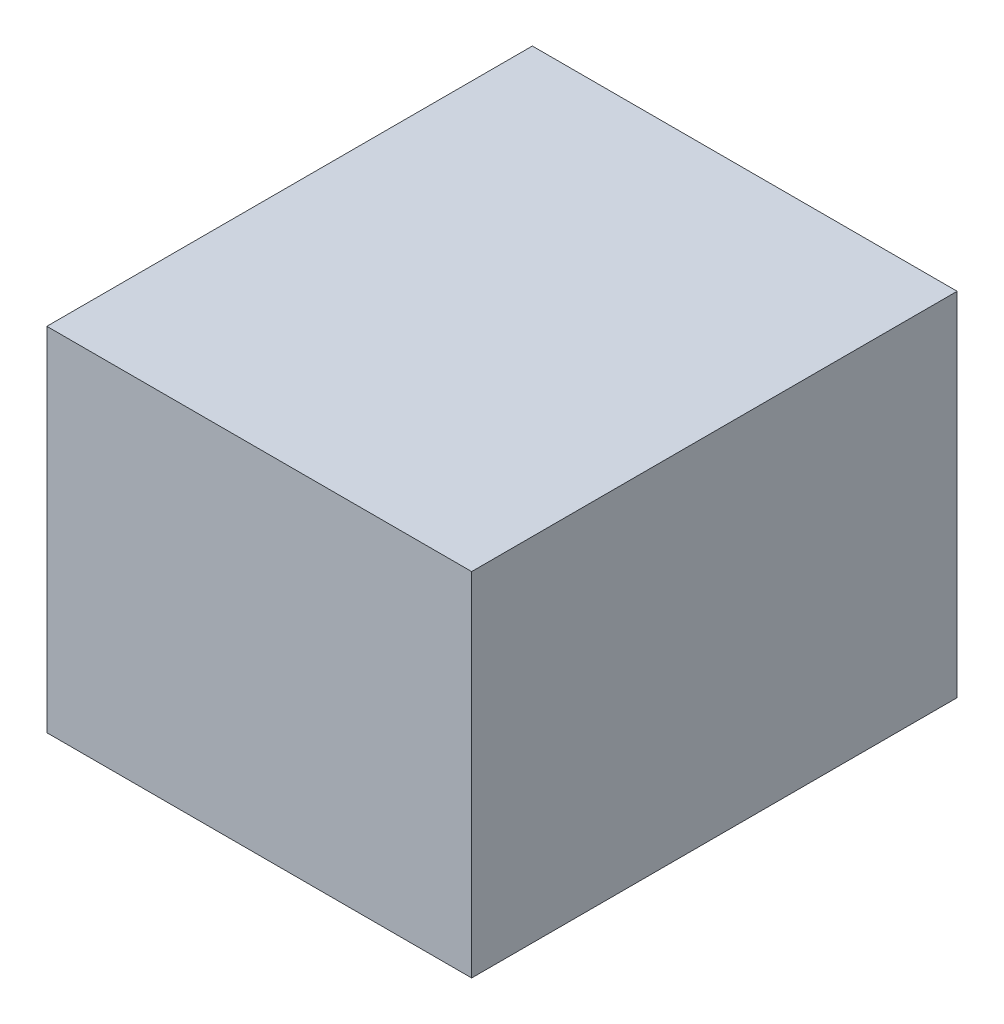
from build123d import *

# Parameters (mm, degrees)
CROQUIS1_W              = 35
CROQUIS1_H              = 40
SALIENTE_EXTRUIR1_DEPTH = 29


with BuildPart() as part:
    # Croquis1 → Saliente-Extruir1 (new body)
    with BuildSketch(Plane(origin=(0, 0, 0), x_dir=(1, 0, 0), z_dir=(0, 1, 0))):
        Rectangle(CROQUIS1_W, CROQUIS1_H)
    extrude(amount=SALIENTE_EXTRUIR1_DEPTH)


solid = part.part
